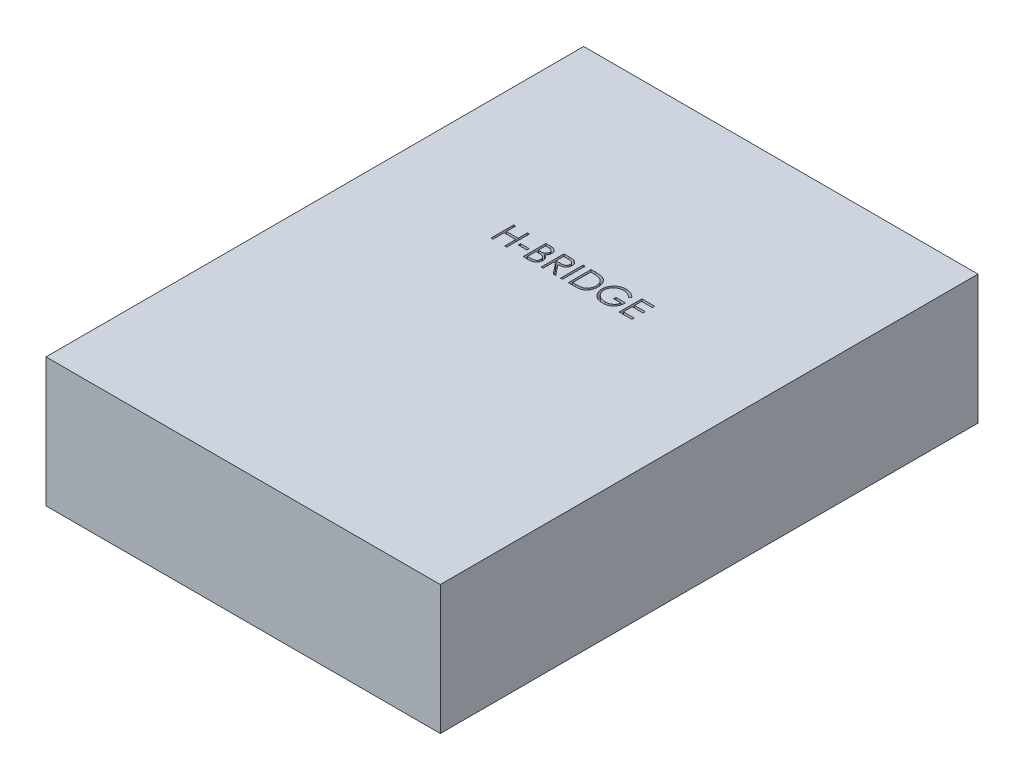
from build123d import *

# Parameters (mm, degrees)
SKETCH1_W           = 55
SKETCH1_H           = 75
BOSS_EXTRUDE1_DEPTH = 18
SKETCH2_W           = 1.221153847
SKETCH2_H           = 0.325641025
SKETCH2_W_2         = 0.284935898
SKETCH2_H_2         = 3.175
CUT_EXTRUDE1_DEPTH  = 1


with BuildPart() as part:
    # Sketch1 → Boss-Extrude1 (new body)
    with BuildSketch(Plane(origin=(0, 0, 0), x_dir=(1, 0, 0), z_dir=(0, 1, 0))):
        Rectangle(SKETCH1_W, SKETCH1_H)
    extrude(amount=BOSS_EXTRUDE1_DEPTH)

    # Sketch2 → Cut-Extrude1 (cut)
    # profile 1 of 8: a face of its own
    with BuildSketch(Plane(origin=(0, 18, 0), x_dir=(1, 0, 0), z_dir=(0, 1, 0))):
        Polygon((-10.822032989, 11.065707866), (-10.537097092, 11.065707866), (-10.537097092, 9.763143764), (-8.908891964, 9.763143764), (-8.908891964, 11.065707866), (-8.623956066, 11.065707866), (-8.623956066, 7.890707866), (-8.908891964, 7.890707866), (-8.908891964, 9.437502738), (-10.537097092, 9.437502738), (-10.537097092, 7.890707866), (-10.822032989, 7.890707866), align=None)
    # profile 2 of 8: a face of its own
    with BuildSketch(Plane(origin=(0, 18, 0), x_dir=(1, 0, 0), z_dir=(0, 1, 0))):
        with Locations((-7.484212476, 9.111861713)):
            Rectangle(SKETCH2_W, SKETCH2_H)
    # profile 3 of 8: a face of its own
    with BuildSketch(Plane(origin=(0, 18, 0), x_dir=(1, 0, 0), z_dir=(0, 1, 0))):
        with BuildLine():
            Line((-6.344468887, 11.065707866), (-5.724987717, 11.065707866))
            add(Edge.make_bspline(
                [(-5.724987717, 11.065707866), (-5.694663312, 11.065548436), (-5.635887067, 11.065239419), (-5.550416574, 11.060446865), (-5.470362295, 11.053912107), (-5.395701016, 11.04354338), (-5.326467236, 11.031032268), (-5.262452308, 11.015881335), (-5.203859795, 10.997714335), (-5.133907527, 10.968825209), (-5.054150927, 10.925896334), (-4.967792385, 10.862461136), (-4.893947111, 10.784870973), (-4.830278095, 10.697347421), (-4.779658508, 10.601067114), (-4.743037788, 10.49832485), (-4.719853144, 10.390445841), (-4.717468778, 10.316383816), (-4.716263759, 10.27895406)],
                knots=[0, 0, 0, 0, 1.001505555, 1.941167018, 2.826882275, 3.653841531, 4.429895133, 5.150066043, 5.825578002, 6.45369114, 7.647487171, 8.808567382, 9.977351308, 11.170798116, 12.373658725, 13.556498008, 14.765093433, 16, 16, 16, 16], degree=3))
            add(Edge.make_bspline(
                [(-4.716263759, 10.27895406), (-4.717255464, 10.24389067), (-4.719204258, 10.174987803), (-4.737839476, 10.074209575), (-4.767013796, 9.978278112), (-4.807567844, 9.88754352), (-4.860274655, 9.804055885), (-4.922738987, 9.727141722), (-4.998101515, 9.660057549), (-5.054565025, 9.62255363), (-5.08324593, 9.603503339)],
                knots=[0, 0, 0, 0, 1.044552857, 2.05264487, 3.044412934, 4.028983338, 5.005914585, 5.980388656, 6.974128949, 8, 8, 8, 8], degree=3))
            add(Edge.make_bspline(
                [(-5.08324593, 9.603503339), (-5.047177542, 9.589655804), (-4.978169781, 9.56316204), (-4.883204613, 9.516321298), (-4.801385003, 9.46537424), (-4.732081878, 9.409737491), (-4.672811291, 9.349767355), (-4.621056123, 9.284584502), (-4.576895162, 9.213338628), (-4.539055581, 9.136772564), (-4.50952921, 9.055668125), (-4.487416782, 8.970786064), (-4.474746311, 8.882430753), (-4.472943236, 8.822300445), (-4.472032989, 8.791944846)],
                knots=[0, 0, 0, 0, 1.27268992, 2.434971085, 3.483601985, 4.442670788, 5.356604649, 6.2567628, 7.179492994, 8.113709626, 9.066344395, 10.018646069, 10.999752585, 12, 12, 12, 12], degree=3))
            add(Edge.make_bspline(
                [(-4.472032989, 8.791944846), (-4.472919128, 8.760950612), (-4.474662631, 8.699968588), (-4.487525891, 8.610383573), (-4.509305581, 8.524772014), (-4.539305836, 8.44258017), (-4.578460221, 8.363967048), (-4.626110589, 8.288843587), (-4.682926364, 8.217964587), (-4.746483395, 8.150542443), (-4.818385484, 8.089920093), (-4.895960491, 8.035930845), (-4.980185367, 7.991529774), (-5.069676818, 7.954231669), (-5.165438734, 7.925740854), (-5.267041099, 7.90580859), (-5.374396287, 7.892378306), (-5.448065133, 7.891274128), (-5.485845089, 7.890707866)],
                knots=[0, 0, 0, 0, 0.978564426, 1.925352924, 2.850884081, 3.763762016, 4.682927383, 5.618979971, 6.567305752, 7.547517671, 8.540179244, 9.531824382, 10.526200242, 11.540722885, 12.589160233, 13.674978461, 14.80764778, 16, 16, 16, 16], degree=3))
            Line((-5.485845089, 7.890707866), (-6.344468887, 7.890707866))
            Line((-6.344468887, 7.890707866), (-6.344468887, 11.065707866))
        make_face()
        with BuildLine():
            Line((-6.059532989, 10.740066841), (-6.059532989, 9.722438636))
            Line((-6.059532989, 9.722438636), (-5.868091683, 9.722438636))
            add(Edge.make_bspline(
                [(-5.868091683, 9.722438636), (-5.840107419, 9.722801423), (-5.786036117, 9.723502402), (-5.70773164, 9.725510378), (-5.635046802, 9.731132889), (-5.568107067, 9.736753784), (-5.50701785, 9.745892874), (-5.45191449, 9.756771443), (-5.401932192, 9.768276649), (-5.344292747, 9.787843255), (-5.278912286, 9.816760861), (-5.209213685, 9.861638883), (-5.147768845, 9.91509169), (-5.095882824, 9.976769205), (-5.053418133, 10.044683531), (-5.023923549, 10.117751058), (-5.003923512, 10.194150749), (-5.002116909, 10.246600164), (-5.001199656, 10.273229902)],
                knots=[0, 0, 0, 0, 1.156816544, 2.235205308, 3.236616184, 4.169592532, 5.011045266, 5.787822928, 6.49130361, 7.128639758, 8.301311294, 9.436451833, 10.541879658, 11.654887649, 12.756523258, 13.837046038, 14.901820046, 16, 16, 16, 16], degree=3))
            add(Edge.make_bspline(
                [(-5.001199656, 10.273229902), (-5.001676977, 10.290851851), (-5.002613293, 10.32541923), (-5.010281646, 10.37581043), (-5.023315089, 10.423202977), (-5.040055769, 10.468246349), (-5.063449794, 10.509532099), (-5.090993793, 10.548487712), (-5.124272954, 10.583786562), (-5.162152802, 10.616778893), (-5.205703482, 10.646029286), (-5.254899011, 10.671647692), (-5.310404975, 10.692276826), (-5.371285922, 10.710343621), (-5.43847898, 10.723033002), (-5.511208753, 10.733604289), (-5.590070963, 10.738986134), (-5.644631163, 10.73969857), (-5.672834271, 10.740066841)],
                knots=[0, 0, 0, 0, 0.91205012, 1.789085906, 2.630437955, 3.453916878, 4.269457761, 5.079663411, 5.91843418, 6.774407191, 7.675494373, 8.627863946, 9.638891023, 10.736472738, 11.911756761, 13.175263542, 14.539845004, 16, 16, 16, 16], degree=3))
            Line((-5.672834271, 10.740066841), (-6.059532989, 10.740066841))
        make_face(mode=Mode.SUBTRACT)
        with BuildLine():
            Line((-6.059532989, 9.39679761), (-6.059532989, 8.216348892))
            Line((-6.059532989, 8.216348892), (-5.653753743, 8.216348892))
            add(Edge.make_bspline(
                [(-5.653753743, 8.216348892), (-5.624708003, 8.216697006), (-5.568726168, 8.217367949), (-5.487898624, 8.219558295), (-5.412983951, 8.224540574), (-5.344323999, 8.232383594), (-5.281177374, 8.240891188), (-5.224301601, 8.252331421), (-5.173235632, 8.265438692), (-5.11402251, 8.285698977), (-5.047344328, 8.317173633), (-4.975488765, 8.36463011), (-4.911602125, 8.421166253), (-4.857350211, 8.486599297), (-4.812888428, 8.557747715), (-4.780543837, 8.633172425), (-4.760594988, 8.711627153), (-4.758180021, 8.765118386), (-4.756968887, 8.791944846)],
                knots=[0, 0, 0, 0, 1.160039823, 2.235823828, 3.228722157, 4.157150951, 4.99529583, 5.772374946, 6.472645482, 7.099169577, 8.269452708, 9.405989375, 10.527446681, 11.663510218, 12.788923519, 13.866172445, 14.929861265, 16, 16, 16, 16], degree=3))
            add(Edge.make_bspline(
                [(-4.756968887, 8.791944846), (-4.757219353, 8.808720947), (-4.757716245, 8.842002551), (-4.765209803, 8.890911901), (-4.776108099, 8.938288229), (-4.790197328, 8.984260179), (-4.810716416, 9.027996599), (-4.834670925, 9.070362493), (-4.862757339, 9.111413863), (-4.90652169, 9.16331355), (-4.970177704, 9.223109698), (-5.060625993, 9.281654432), (-5.163470864, 9.328869228), (-5.238062947, 9.34891661), (-5.276595289, 9.35927257)],
                knots=[0, 0, 0, 0, 0.723448775, 1.435228256, 2.130040452, 2.821711965, 3.505591119, 4.210454504, 4.921174351, 5.648778258, 7.137944449, 8.670945889, 10.280296675, 12, 12, 12, 12], degree=3))
            add(Edge.make_bspline(
                [(-5.276595289, 9.35927257), (-5.292043112, 9.362406825), (-5.325537178, 9.369202535), (-5.380154054, 9.376375952), (-5.442507307, 9.382766828), (-5.512740917, 9.387494092), (-5.590943744, 9.392380457), (-5.677282806, 9.394280759), (-5.771405513, 9.396547945), (-5.836712879, 9.396712259), (-5.870635754, 9.39679761)],
                knots=[0, 0, 0, 0, 0.634451884, 1.375622551, 2.216452059, 3.157844607, 4.20941857, 5.370758133, 6.634282058, 8, 8, 8, 8], degree=3))
            Line((-5.870635754, 9.39679761), (-6.059532989, 9.39679761))
        make_face(mode=Mode.SUBTRACT)
    # profile 4 of 8: a face of its own
    with BuildSketch(Plane(origin=(0, 18, 0), x_dir=(1, 0, 0), z_dir=(0, 1, 0))):
        with BuildLine():
            Line((-3.820750938, 11.065707866), (-3.185369327, 11.065707866))
            add(Edge.make_bspline(
                [(-3.185369327, 11.065707866), (-3.142968447, 11.065566728), (-3.061554058, 11.065295726), (-2.944919735, 11.063784641), (-2.838940868, 11.059453618), (-2.743672871, 11.055726546), (-2.659117491, 11.048930285), (-2.585015449, 11.042434555), (-2.521708037, 11.033931306), (-2.483385015, 11.026034243), (-2.46603339, 11.022458668)],
                knots=[0, 0, 0, 0, 1.410062039, 2.707475311, 3.878576406, 4.937260626, 5.877586885, 6.699081471, 7.410979367, 8, 8, 8, 8], degree=3))
            add(Edge.make_bspline(
                [(-2.46603339, 11.022458668), (-2.442804524, 11.016719388), (-2.396842326, 11.005363262), (-2.330666195, 10.981360624), (-2.267606772, 10.95358425), (-2.207926003, 10.920960018), (-2.151922821, 10.883245754), (-2.099019782, 10.841092529), (-2.048976826, 10.794730992), (-2.003817776, 10.742992243), (-1.96123735, 10.688711981), (-1.925324811, 10.63001643), (-1.894367218, 10.568637758), (-1.869719678, 10.503951744), (-1.84987323, 10.436585708), (-1.835879428, 10.365929442), (-1.827487279, 10.292304843), (-1.826632881, 10.242087312), (-1.826199656, 10.216624333)],
                knots=[0, 0, 0, 0, 1.027469482, 2.033020251, 3.019912614, 3.986113645, 4.951240523, 5.91722682, 6.890402269, 7.87763091, 8.8651537, 9.85103654, 10.82876324, 11.815024772, 12.821070561, 13.842952187, 14.906261191, 16, 16, 16, 16], degree=3))
            add(Edge.make_bspline(
                [(-1.826199656, 10.216624333), (-1.827532247, 10.174319631), (-1.830132478, 10.0917722), (-1.854375965, 9.971974115), (-1.894087522, 9.860223808), (-1.948809362, 9.756661986), (-2.018495601, 9.663307329), (-2.102247376, 9.581310273), (-2.200111409, 9.512694067), (-2.291215146, 9.46511188), (-2.371691598, 9.434638313), (-2.437943246, 9.413196759), (-2.510212576, 9.396630547), (-2.587807158, 9.381789571), (-2.671049903, 9.370584819), (-2.759741296, 9.362378266), (-2.85394459, 9.357249236), (-2.918659317, 9.356485417), (-2.951950858, 9.356092482)],
                knots=[0, 0, 0, 0, 1.260483769, 2.459530307, 3.627416485, 4.787058657, 5.939039949, 7.08810263, 8.267026773, 9.491475466, 10.141966685, 10.831826277, 11.566392101, 12.351337768, 13.187381173, 14.07005841, 15.007169909, 16, 16, 16, 16], degree=3))
            Line((-2.951950858, 9.356092482), (-1.785494528, 7.890707866))
            Line((-1.785494528, 7.890707866), (-2.137848294, 7.890707866))
            Line((-2.137848294, 7.890707866), (-3.304304624, 9.356092482))
            Line((-3.304304624, 9.356092482), (-3.535815041, 9.356092482))
            Line((-3.535815041, 9.356092482), (-3.535815041, 7.890707866))
            Line((-3.535815041, 7.890707866), (-3.820750938, 7.890707866))
            Line((-3.820750938, 7.890707866), (-3.820750938, 11.065707866))
        make_face()
        with BuildLine():
            Line((-3.535815041, 10.740066841), (-3.535815041, 9.681733507))
            Line((-3.535815041, 9.681733507), (-2.954494928, 9.677281384))
            add(Edge.make_bspline(
                [(-2.954494928, 9.677281384), (-2.927353179, 9.677269376), (-2.874744738, 9.677246102), (-2.798634849, 9.680869028), (-2.727768748, 9.684990467), (-2.662417494, 9.691294516), (-2.602551893, 9.699418952), (-2.548201869, 9.70958166), (-2.4992787, 9.721421745), (-2.44222074, 9.739747505), (-2.378506172, 9.768781536), (-2.309262634, 9.811023096), (-2.250296227, 9.864153654), (-2.200477881, 9.924908146), (-2.160446182, 9.991706743), (-2.132223105, 10.063748735), (-2.114313889, 10.139215399), (-2.112201566, 10.191084111), (-2.111135553, 10.21726035)],
                knots=[0, 0, 0, 0, 1.146690395, 2.22261258, 3.21895312, 4.145990853, 4.996080663, 5.770904154, 6.481378293, 7.121626537, 8.300444488, 9.431385265, 10.535395872, 11.636531494, 12.74115979, 13.810798291, 14.895190096, 16, 16, 16, 16], degree=3))
            add(Edge.make_bspline(
                [(-2.111135553, 10.21726035), (-2.112226049, 10.242793314), (-2.114387013, 10.29339033), (-2.132029825, 10.367463906), (-2.161865192, 10.437374639), (-2.202071794, 10.502838136), (-2.251056741, 10.562261197), (-2.308495043, 10.613103971), (-2.372816184, 10.655058843), (-2.432933628, 10.681868888), (-2.486667521, 10.698306183), (-2.53332157, 10.709873311), (-2.586036982, 10.719166507), (-2.645069719, 10.726612391), (-2.71016777, 10.733012234), (-2.781660289, 10.737322776), (-2.85907294, 10.739875352), (-2.912727656, 10.740001526), (-2.940502541, 10.740066841)],
                knots=[0, 0, 0, 0, 1.101028733, 2.181837193, 3.264309656, 4.369019818, 5.486613113, 6.575447106, 7.666700264, 8.788928104, 9.402425223, 10.0903467, 10.862060571, 11.710948788, 12.657782767, 13.684531032, 14.801375019, 16, 16, 16, 16], degree=3))
            Line((-2.940502541, 10.740066841), (-3.535815041, 10.740066841))
        make_face(mode=Mode.SUBTRACT)
    # profile 5 of 8: a face of its own
    with BuildSketch(Plane(origin=(0, 18, 0), x_dir=(1, 0, 0), z_dir=(0, 1, 0))):
        with Locations((-0.991744528, 9.478207866)):
            Rectangle(SKETCH2_W_2, SKETCH2_H_2)
    # profile 6 of 8: a face of its own
    with BuildSketch(Plane(origin=(0, 18, 0), x_dir=(1, 0, 0), z_dir=(0, 1, 0))):
        with BuildLine():
            Line((-0.035174015, 7.890707866), (-0.035174015, 11.065707866))
            Line((-0.035174015, 11.065707866), (0.605931754, 11.065707866))
            add(Edge.make_bspline(
                [(0.605931754, 11.065707866), (0.661692908, 11.065306392), (0.769423166, 11.064530746), (0.925100172, 11.05961277), (1.069139728, 11.050912847), (1.201068108, 11.038240491), (1.321247493, 11.022680239), (1.429341373, 11.003176301), (1.525908674, 10.980145604), (1.585298809, 10.960510088), (1.613383677, 10.951224693)],
                knots=[0, 0, 0, 0, 1.314313732, 2.53924729, 3.670748893, 4.714932338, 5.66265055, 6.526160246, 7.303039223, 8, 8, 8, 8], degree=3))
            add(Edge.make_bspline(
                [(1.613383677, 10.951224693), (1.650118191, 10.937226839), (1.722754201, 10.909548555), (1.826174948, 10.857336767), (1.923534384, 10.798179168), (2.015354609, 10.731997778), (2.099538215, 10.656918691), (2.17937395, 10.576131192), (2.251595878, 10.486697483), (2.317734118, 10.390472315), (2.377365752, 10.288589239), (2.429199131, 10.181242391), (2.472246682, 10.068976923), (2.507981966, 9.952105039), (2.536145539, 9.830369754), (2.555360577, 9.703629318), (2.56803426, 9.572384625), (2.569307935, 9.483326361), (2.56995419, 9.438138756)],
                knots=[0, 0, 0, 0, 0.984719456, 1.947108742, 2.898477687, 3.838006223, 4.779231079, 5.722358779, 6.681677486, 7.655904652, 8.64651281, 9.637519902, 10.640069247, 11.656948941, 12.698408672, 13.768548281, 14.867775369, 16, 16, 16, 16], degree=3))
            add(Edge.make_bspline(
                [(2.56995419, 9.438138756), (2.569383627, 9.398894632), (2.568259272, 9.321559988), (2.558163393, 9.207585747), (2.54348916, 9.096992722), (2.520770494, 8.990307551), (2.493191071, 8.886595525), (2.45784502, 8.786961989), (2.417354248, 8.690492962), (2.370137573, 8.598492823), (2.318302174, 8.511331478), (2.262674592, 8.429166535), (2.203314161, 8.35317044), (2.139654837, 8.283113057), (2.072519266, 8.219099996), (2.001467909, 8.160596525), (1.926317427, 8.108747365), (1.847404414, 8.061515059), (1.762426783, 8.020312308), (1.669774961, 7.985450799), (1.569053821, 7.95656137), (1.460510589, 7.932457771), (1.34395772, 7.913337647), (1.219280944, 7.900522991), (1.086671817, 7.891857116), (0.995613483, 7.891098388), (0.948745256, 7.890707866)],
                knots=[0, 0, 0, 0, 1.105936401, 2.179363191, 3.223086493, 4.248585256, 5.251745608, 6.245858792, 7.225916811, 8.198733463, 9.158002045, 10.082870192, 10.993790845, 11.873723703, 12.748670949, 13.606408763, 14.465103618, 15.319838547, 16.196477973, 17.123216899, 18.106603292, 19.147568657, 20.255746949, 21.433717677, 22.679120308, 24, 24, 24, 24], degree=3))
            Line((0.948745256, 7.890707866), (-0.035174015, 7.890707866))
        make_face()
        with BuildLine():
            Line((0.249761882, 8.216348892), (0.614199983, 8.216348892))
            add(Edge.make_bspline(
                [(0.614199983, 8.216348892), (0.666567863, 8.216573951), (0.767290473, 8.217006821), (0.912123084, 8.220805213), (1.044456537, 8.227011828), (1.16430962, 8.235697791), (1.271614664, 8.247190035), (1.366595923, 8.260003339), (1.44894205, 8.275966741), (1.498770896, 8.29043654), (1.521797139, 8.297123131)],
                knots=[0, 0, 0, 0, 1.375205317, 2.645023457, 3.804390687, 4.853969522, 5.800190428, 6.637939096, 7.370582563, 8, 8, 8, 8], degree=3))
            add(Edge.make_bspline(
                [(1.521797139, 8.297123131), (1.550778867, 8.307329901), (1.608050096, 8.327499654), (1.690492224, 8.364291247), (1.767378935, 8.407872267), (1.840050172, 8.456315759), (1.907475067, 8.511330346), (1.970452658, 8.571719743), (2.028856149, 8.637791289), (2.082082129, 8.709462979), (2.129714662, 8.786288722), (2.170963562, 8.867513235), (2.207114595, 8.952246556), (2.235488747, 9.041789864), (2.257727884, 9.135342653), (2.273480136, 9.232911504), (2.283290636, 9.334478195), (2.28443495, 9.403559051), (2.285018293, 9.438774773)],
                knots=[0, 0, 0, 0, 0.998632004, 1.973411704, 2.929992603, 3.868527914, 4.809262121, 5.754881198, 6.702106254, 7.672490631, 8.653608572, 9.636854334, 10.631411391, 11.644891563, 12.686317036, 13.754757253, 14.855430412, 16, 16, 16, 16], degree=3))
            add(Edge.make_bspline(
                [(2.285018293, 9.438774773), (2.284552668, 9.475907288), (2.283637943, 9.548854441), (2.272140533, 9.655888857), (2.255338836, 9.758832019), (2.231042207, 9.85769081), (2.200080624, 9.952658101), (2.161441199, 10.043208657), (2.117293623, 10.130298788), (2.064767025, 10.211918391), (2.007240022, 10.289109997), (1.943397231, 10.359826242), (1.874252954, 10.424228214), (1.80056134, 10.483318877), (1.720245543, 10.534720925), (1.635197552, 10.580700986), (1.544169693, 10.619722545), (1.480839605, 10.640476942), (1.448655112, 10.651024373)],
                knots=[0, 0, 0, 0, 1.122418816, 2.205001699, 3.251619955, 4.274784885, 5.280384055, 6.268708349, 7.249350384, 8.229342522, 9.199999885, 10.157847722, 11.105861043, 12.055065948, 13.010012805, 13.98527497, 14.976112212, 16, 16, 16, 16], degree=3))
            add(Edge.make_bspline(
                [(1.448655112, 10.651024373), (1.422029429, 10.658387132), (1.365415922, 10.674042379), (1.27303298, 10.691119682), (1.169060665, 10.706182334), (1.053037365, 10.718934984), (0.925095334, 10.728085626), (0.785136175, 10.73495389), (0.63309939, 10.739586335), (0.527705235, 10.739902662), (0.47300407, 10.740066841)],
                knots=[0, 0, 0, 0, 0.674548936, 1.434276114, 2.292660221, 3.240891867, 4.284742987, 5.42552168, 6.663806718, 8, 8, 8, 8], degree=3))
            Line((0.47300407, 10.740066841), (0.249761882, 10.740066841))
            Line((0.249761882, 10.740066841), (0.249761882, 8.216348892))
        make_face(mode=Mode.SUBTRACT)
    # profile 7 of 8: a face of its own
    with BuildSketch(Plane(origin=(0, 18, 0), x_dir=(1, 0, 0), z_dir=(0, 1, 0))):
        with BuildLine():
            Line((6.1927106, 10.523820847), (5.948479831, 10.29231043))
            add(Edge.make_bspline(
                [(5.948479831, 10.29231043), (5.90428484, 10.33388557), (5.816948712, 10.416044468), (5.674563349, 10.522643727), (5.526006338, 10.613962261), (5.372052859, 10.688262918), (5.216515456, 10.747547208), (5.061458638, 10.789754878), (4.908472894, 10.816672109), (4.806721203, 10.819890987), (4.756582796, 10.821477097)],
                knots=[0, 0, 0, 0, 1.08915593, 2.152340314, 3.188132944, 4.216796309, 5.218260357, 6.173443236, 7.099959455, 8, 8, 8, 8], degree=3))
            add(Edge.make_bspline(
                [(4.756582796, 10.821477097), (4.725817318, 10.821101898), (4.664366154, 10.820352471), (4.573087676, 10.810787362), (4.482766513, 10.797030664), (4.393573166, 10.777126246), (4.305334213, 10.751899456), (4.218356547, 10.720344072), (4.132477918, 10.683554672), (4.048507258, 10.641043713), (3.967099802, 10.594344138), (3.890213244, 10.542592962), (3.817357517, 10.487448846), (3.749901989, 10.427531172), (3.687458641, 10.363382687), (3.628541189, 10.296196687), (3.575221785, 10.224137596), (3.527060514, 10.148531207), (3.48409676, 10.070705435), (3.446170339, 9.991409366), (3.414332266, 9.910906012), (3.389141403, 9.829094356), (3.368358167, 9.746607321), (3.353737195, 9.662873753), (3.345494239, 9.577803996), (3.34406841, 9.520837911), (3.343351626, 9.492200254)],
                knots=[0, 0, 0, 0, 1.02818874, 2.053710826, 3.065248034, 4.081641283, 5.106893873, 6.131558223, 7.173050175, 8.228653731, 9.27666206, 10.308777013, 11.325269123, 12.329503258, 13.32196095, 14.316845687, 15.314881793, 16.315733098, 17.311955233, 18.285320748, 19.252783886, 20.203351036, 21.145449891, 22.095197417, 23.042428769, 24, 24, 24, 24], degree=3))
            add(Edge.make_bspline(
                [(3.343351626, 9.492200254), (3.34403717, 9.462926013), (3.345406387, 9.404457468), (3.354169677, 9.317195703), (3.370433153, 9.231229945), (3.392175288, 9.14627771), (3.419372171, 9.062193506), (3.453274518, 8.979341872), (3.493429742, 8.897725874), (3.539908614, 8.818080893), (3.590877527, 8.740499294), (3.647975893, 8.667420299), (3.708627994, 8.597870765), (3.77504346, 8.533394894), (3.845092616, 8.472268074), (3.920868324, 8.416174422), (4.000880556, 8.364033462), (4.085251384, 8.316502334), (4.173065337, 8.274040305), (4.263105391, 8.236281485), (4.355659195, 8.205185229), (4.450240349, 8.179841377), (4.546736103, 8.159067536), (4.645636267, 8.145703072), (4.746213652, 8.136004961), (4.814012269, 8.135295875), (4.848169334, 8.134938636)],
                knots=[0, 0, 0, 0, 0.93586088, 1.869166235, 2.799637598, 3.729985548, 4.670839027, 5.622275134, 6.589130586, 7.576015415, 8.568469353, 9.55398029, 10.53834874, 11.515998671, 12.510579167, 13.508179873, 14.527009472, 15.561807829, 16.601455013, 17.643573243, 18.680854198, 19.719860599, 20.772568776, 21.833555941, 22.908541556, 24, 24, 24, 24], degree=3))
            add(Edge.make_bspline(
                [(4.848169334, 8.134938636), (4.889333978, 8.13579913), (4.970167443, 8.13748885), (5.088990859, 8.150642684), (5.203112216, 8.171186561), (5.312210844, 8.201272767), (5.416413455, 8.239648244), (5.516102052, 8.285908345), (5.610491771, 8.341827405), (5.699866364, 8.404940842), (5.782196097, 8.475257868), (5.856449481, 8.551135339), (5.921442174, 8.632204942), (5.978142866, 8.717989192), (6.025050002, 8.809198147), (6.063551681, 8.905384829), (6.093064024, 9.006592501), (6.105178894, 9.076525624), (6.111300344, 9.111861713)],
                knots=[0, 0, 0, 0, 1.13008108, 2.219097802, 3.278683437, 4.311054135, 5.322181354, 6.324827112, 7.324222904, 8.330512327, 9.32562643, 10.293043162, 11.24128371, 12.174520618, 13.111833804, 14.052305215, 15.015860969, 16, 16, 16, 16], degree=3))
            Line((6.111300344, 9.111861713), (5.052967011, 9.111861713))
            Line((5.052967011, 9.111861713), (5.052967011, 9.437502738))
            Line((5.052967011, 9.437502738), (6.396236241, 9.437502738))
            add(Edge.make_bspline(
                [(6.396236241, 9.437502738), (6.394688793, 9.376808088), (6.391660158, 9.258017693), (6.370415856, 9.084780375), (6.336110877, 8.921157482), (6.289247594, 8.766976696), (6.228582161, 8.622456508), (6.154765653, 8.487450187), (6.066616657, 8.362829912), (5.967275043, 8.247578316), (5.855787224, 8.14477253), (5.73516569, 8.054415715), (5.605211154, 7.978304057), (5.466046543, 7.916381885), (5.318127436, 7.868054761), (5.161111548, 7.833790545), (4.995211811, 7.813261935), (4.881513539, 7.810639041), (4.823364647, 7.80929761)],
                knots=[0, 0, 0, 0, 1.140356446, 2.231883559, 3.274166699, 4.278491846, 5.25512956, 6.21435461, 7.1637429, 8.11826594, 9.068280886, 10.0076534, 10.945064095, 11.891975133, 12.864533718, 13.863980011, 14.907571808, 16, 16, 16, 16], degree=3))
            add(Edge.make_bspline(
                [(4.823364647, 7.80929761), (4.78752331, 7.809813884), (4.716832642, 7.810832143), (4.612428728, 7.818068737), (4.510903458, 7.829208974), (4.412271622, 7.846032051), (4.316170411, 7.866637487), (4.223079788, 7.893023296), (4.132645136, 7.923565616), (4.044726678, 7.958305263), (3.96012241, 7.998556694), (3.878455498, 8.043287581), (3.799274513, 8.092267273), (3.723118813, 8.146342826), (3.649591599, 8.205109772), (3.579166976, 8.268685898), (3.511450686, 8.336876843), (3.469032266, 8.38529923), (3.447658517, 8.409698251)],
                knots=[0, 0, 0, 0, 1.107784379, 2.184907829, 3.233506516, 4.263428166, 5.276301166, 6.270063455, 7.25232949, 8.225834625, 9.190232166, 10.146266622, 11.1027726, 12.066435141, 13.031522626, 14.010570082, 14.99756817, 16, 16, 16, 16], degree=3))
            add(Edge.make_bspline(
                [(3.447658517, 8.409698251), (3.416646993, 8.448406629), (3.355138705, 8.525180866), (3.275964948, 8.648189387), (3.208472247, 8.775553932), (3.153710008, 8.907629059), (3.11094903, 9.04429123), (3.080281929, 9.185365816), (3.062313888, 9.331034481), (3.059725322, 9.4296094), (3.058415729, 9.479479902)],
                knots=[0, 0, 0, 0, 1.023165419, 2.029347347, 3.013907458, 3.994755782, 4.975994455, 5.96558838, 6.970761222, 8, 8, 8, 8], degree=3))
            add(Edge.make_bspline(
                [(3.058415729, 9.479479902), (3.058898545, 9.516823574), (3.05985804, 9.591036303), (3.071492616, 9.701215432), (3.088185331, 9.809438202), (3.112720873, 9.91561615), (3.143651056, 10.019820187), (3.182253147, 10.122098697), (3.227197445, 10.222512037), (3.279435717, 10.320369046), (3.337569477, 10.414371192), (3.400661462, 10.504140057), (3.469607585, 10.588040851), (3.543281918, 10.667136132), (3.622563473, 10.740432229), (3.706709522, 10.808607744), (3.795784911, 10.871754127), (3.890069875, 10.928876762), (3.988157131, 10.980188047), (4.089811561, 11.025172546), (4.195002133, 11.062350268), (4.302940774, 11.093895053), (4.414444506, 11.11722236), (4.528704172, 11.134139436), (4.646315345, 11.145715123), (4.725813743, 11.146646083), (4.76612306, 11.147118123)],
                knots=[0, 0, 0, 0, 1.008945113, 2.00506715, 2.99143336, 3.967273523, 4.948097931, 5.927297278, 6.919902385, 7.919676788, 8.923139349, 9.905703106, 10.883022732, 11.856032218, 12.825136022, 13.798837087, 14.781400844, 15.773989409, 16.776158564, 17.77167057, 18.775803737, 19.789618931, 20.80898985, 21.851988756, 22.910860228, 24, 24, 24, 24], degree=3))
            add(Edge.make_bspline(
                [(4.76612306, 11.147118123), (4.798996324, 11.146592441), (4.864180144, 11.145550076), (4.961177058, 11.138325002), (5.056674721, 11.126873339), (5.150814732, 11.111246182), (5.243276507, 11.089961263), (5.334323447, 11.064490248), (5.424087533, 11.034834094), (5.512287445, 10.999465641), (5.59951623, 10.959321281), (5.6862589, 10.914133391), (5.772219073, 10.863129279), (5.857545821, 10.806157501), (5.942777206, 10.744196543), (6.026565132, 10.675474282), (6.110932088, 10.602700782), (6.165180877, 10.550374801), (6.1927106, 10.523820847)],
                knots=[0, 0, 0, 0, 0.985871117, 1.954866573, 2.915460327, 3.869826059, 4.81536089, 5.759505086, 6.70452669, 7.649098992, 8.607881297, 9.583363685, 10.581137262, 11.603961102, 12.659522466, 13.73993555, 14.853081303, 16, 16, 16, 16], degree=3))
        make_face()
    # profile 8 of 8: a face of its own
    with BuildSketch(Plane(origin=(0, 18, 0), x_dir=(1, 0, 0), z_dir=(0, 1, 0))):
        Polygon((7.047518293, 11.065707866), (8.838543934, 11.065707866), (8.838543934, 10.740066841), (7.33245419, 10.740066841), (7.33245419, 9.763143764), (8.838543934, 9.763143764), (8.838543934, 9.437502738), (7.33245419, 9.437502738), (7.33245419, 8.216348892), (8.838543934, 8.216348892), (8.838543934, 7.890707866), (7.047518293, 7.890707866), align=None)
    extrude(amount=-CUT_EXTRUDE1_DEPTH, mode=Mode.SUBTRACT)


solid = part.part
